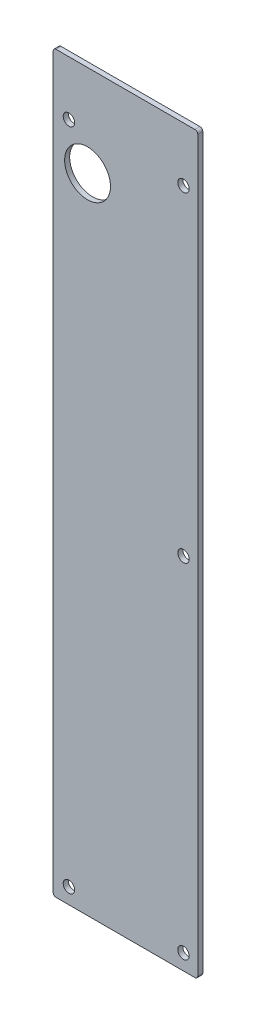
from build123d import *

# Parameters (mm, degrees)
SKETCH1_W           = 160.3375
SKETCH1_H           = 814.3875
BOSS_EXTRUDE1_DEPTH = 5.588
FILLET1_R           = 3.175
SKETCH2_R           = 6.35
CUT_EXTRUDE1_DEPTH  = 6.35
SKETCH3_R           = 25.4
CUT_EXTRUDE2_DEPTH  = 831.039962777


with BuildPart() as part:
    # Sketch1 → Boss-Extrude1 (new body)
    with BuildSketch(Plane.XY):
        with Locations((80.16875, 407.19375)):
            Rectangle(SKETCH1_W, SKETCH1_H)
    extrude(amount=BOSS_EXTRUDE1_DEPTH)

    # Fillet1
    fillet1_edges = [part.edges().sort_by_distance(p)[0] for p in [
        (0, 814.3875, 2.794),
        (160.3375, 814.3875, 2.794),
        (160.3375, 0, 2.794),
        (0, 0, 2.794),
    ]]
    fillet(fillet1_edges, radius=FILLET1_R)

    # Sketch2 → Cut-Extrude1 (cut)
    with BuildSketch(Plane.XY.offset(5.588)):
        with Locations((17.4625, 754.0625)):
            Circle(SKETCH2_R)
        with Locations((144.4625, 754.0625)):
            Circle(SKETCH2_R)
        with Locations((17.4625, 17.4625)):
            Circle(SKETCH2_R)
        with Locations((144.4625, 17.4625)):
            Circle(SKETCH2_R)
        with Locations((144.4625, 398.4625)):
            Circle(SKETCH2_R)
    extrude(amount=-CUT_EXTRUDE1_DEPTH, mode=Mode.SUBTRACT)

    # Sketch3 → Cut-Extrude2 (cut, through all)
    with BuildSketch(Plane.XY.offset(5.588)):
        with Locations((38.1, 712.7875)):
            Circle(SKETCH3_R)
    extrude(amount=-CUT_EXTRUDE2_DEPTH, mode=Mode.SUBTRACT)


solid = part.part
